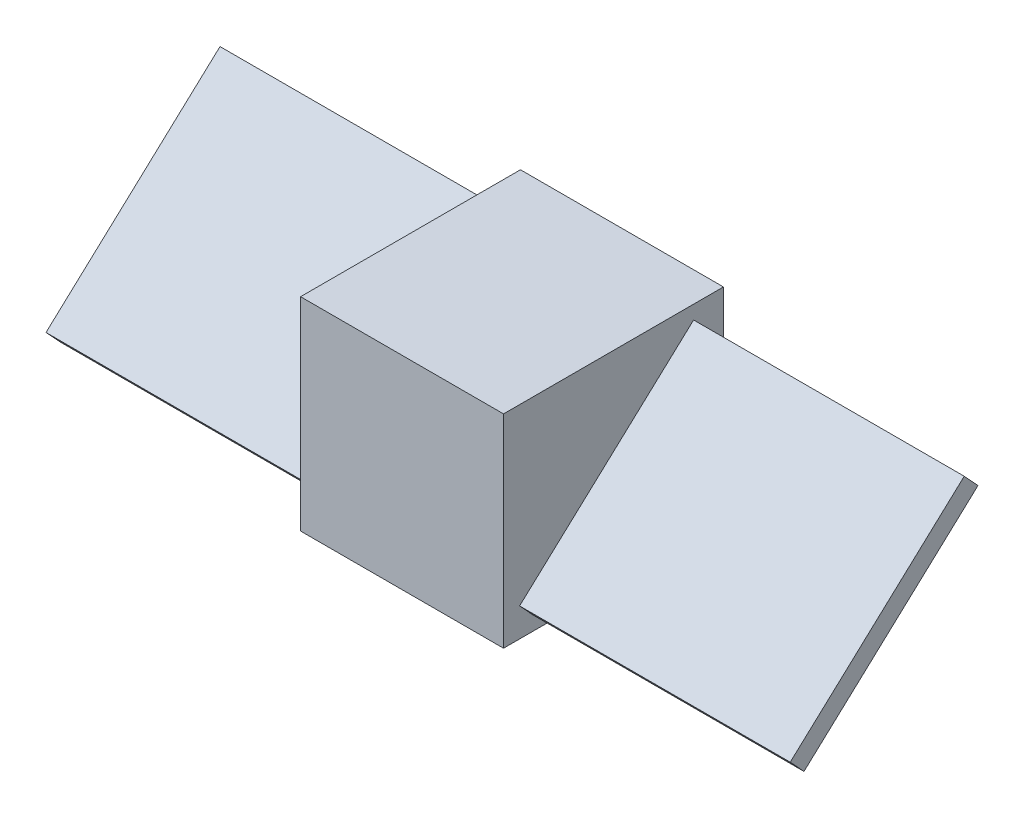
from build123d import *

# Parameters (mm, degrees)
SKETCH1_W           = 60
SKETCH1_H           = 65
BOSS_EXTRUDE1_DEPTH = 60
BOSS_EXTRUDE2_DEPTH = 80


with BuildPart() as part:
    # Sketch1 → Boss-Extrude1 (new body)
    with BuildSketch(Plane(origin=(0, 0, 0), x_dir=(1, 0, 0), z_dir=(0, 1, 0))):
        Rectangle(SKETCH1_W, SKETCH1_H)
    extrude(amount=BOSS_EXTRUDE1_DEPTH)


with BuildPart() as body_2:
    # Sketch2 → Boss-Extrude2 (new body)
    with BuildSketch(Plane(origin=(30, 0, 0), x_dir=(0, 0, -1), z_dir=(1, 0, 0))):
        Polygon((-27.75296087, 8.464606738), (-23.683280254, 4.05578607), (27.75296087, 51.535393262), (23.683280254, 55.94421393), align=None)
    extrude(amount=BOSS_EXTRUDE2_DEPTH)


with BuildPart() as body_3:
    # Mirror1: mirrored copy
    add(body_2.part.mirror(Plane(origin=(0, 0, 0), x_dir=(0, 0, 1), z_dir=(1, 0, 0))))


solid = Compound([part.part, body_2.part, body_3.part])
